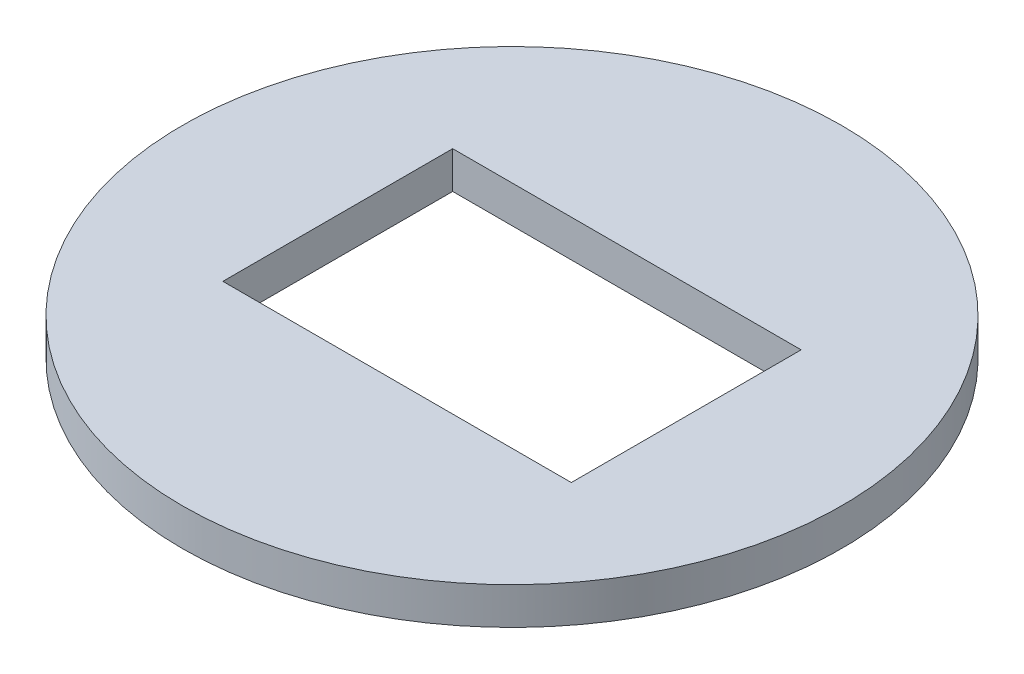
from build123d import *

# Parameters (mm, degrees)
SKETCH1_R           = 88.9
BOSS_EXTRUDE1_DEPTH = 10
SKETCH2_W           = 94
SKETCH2_H           = 62
CUT_EXTRUDE1_DEPTH  = 30


with BuildPart() as part:
    # Sketch1 → Boss-Extrude1 (new body)
    with BuildSketch(Plane(origin=(0, 0, 0), x_dir=(1, 0, 0), z_dir=(0, 1, 0))):
        with Locations(Location((0, 0, 0), (0, 0, 270))):
            Circle(SKETCH1_R)
    extrude(amount=BOSS_EXTRUDE1_DEPTH)

    # Sketch2 → Cut-Extrude1 (cut)
    with BuildSketch(Plane.XZ.offset(10)):
        Rectangle(SKETCH2_W, SKETCH2_H)
    extrude(amount=-CUT_EXTRUDE1_DEPTH, mode=Mode.SUBTRACT)


solid = part.part
